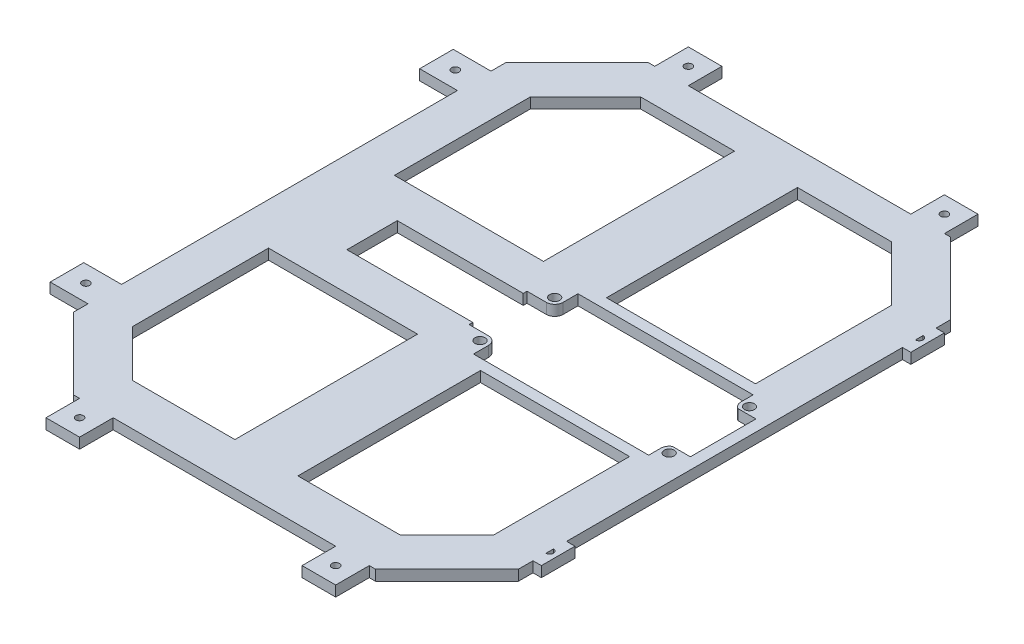
from build123d import *

# Parameters (mm, degrees)
SKETCH1_W               = 106
SKETCH1_H               = 137
BOSS_EXTRUDE1_DEPTH     = 2.5
CUT_EXTRUDE1_DEPTH      = 174.237553665
CUT_EXTRUDE1_DEPTH_BACK = 174.237553665
SKETCH5_W               = 8
SKETCH5_H               = 8
SKETCH5_R               = 0.9
SKETCH5_W_2             = 9
BOSS_EXTRUDE4_DEPTH     = 2.5
CUT_EXTRUDE4_DEPTH      = 181.818278943
CUT_EXTRUDE4_DEPTH_BACK = 181.818278943
SKETCH3_R               = 1.2
SKETCH3_W               = 6.263237977
SKETCH3_H               = 0.25
SKETCH3_W_2             = 4.268245837
CUT_EXTRUDE5_DEPTH      = 181.818278943
CUT_EXTRUDE5_DEPTH_BACK = 181.818278943
SKETCH7_W               = 30
SKETCH7_H               = 12


with BuildPart() as part:
    # Sketch1 → Boss-Extrude1 (new body)
    with BuildSketch(Plane(origin=(0, 0, 0), x_dir=(1, 0, 0), z_dir=(0, 1, 0))):
        with Locations((53, -68.5)):
            Rectangle(SKETCH1_W, SKETCH1_H)
    extrude(amount=BOSS_EXTRUDE1_DEPTH)

    # Sketch2 → Cut-Extrude1 (cut, two sides: drawn at the far end of the back side and taken through both)
    with BuildSketch(Plane(origin=(0, 2.5, 0), x_dir=(1, 0, 0), z_dir=(0, 1, 0)).offset(-CUT_EXTRUDE1_DEPTH_BACK)):
        Polygon((60.5, -83.5), (96, -83.5), (96, -115.857864376), (84.857864376, -127), (60.5, -127), align=None)
        Polygon((106, -120), (89, -137), (106, -137), align=None)
        Polygon((17, -137), (0, -120), (0, -137), align=None)
        Polygon((45.5, -127), (21.142135624, -127), (10, -115.857864376), (10, -83.5), (45.5, -83.5), align=None)
        Polygon((10, -53.5), (45.5, -53.5), (45.5, -8), (23.142135624, -8), (10, -21.142135624), align=None)
        Polygon((60.5, -53.5), (60.5, -8), (82.857864376, -8), (96, -21.142135624), (96, -53.5), align=None)
        Polygon((106, 0), (89, 0), (106, -17), align=None)
        Polygon((0, 0), (0, -17), (17, 0), align=None)
    extrude(amount=CUT_EXTRUDE1_DEPTH + CUT_EXTRUDE1_DEPTH_BACK, mode=Mode.SUBTRACT)

    # Sketch5 → Boss-Extrude4 (add)
    # profile 1 of 8: a face of its own
    with BuildSketch(Plane(origin=(0, 0, 0), x_dir=(1, 0, 0), z_dir=(0, 1, 0))):
        with Locations((22.5, -141)):
            Rectangle(SKETCH5_W, SKETCH5_H)
        with Locations(Location((22.5, -141, 0), (0, 0, 270))):
            Circle(SKETCH5_R, mode=Mode.SUBTRACT)
    # profile 2 of 8: a face of its own
    with BuildSketch(Plane(origin=(0, 0, 0), x_dir=(1, 0, 0), z_dir=(0, 1, 0))):
        with Locations((83.5, -141)):
            Rectangle(SKETCH5_W, SKETCH5_H)
        with Locations(Location((83.5, -141, 0), (0, 0, 270))):
            Circle(SKETCH5_R, mode=Mode.SUBTRACT)
    # profile 3 of 8: a face of its own
    with BuildSketch(Plane(origin=(0, 0, 0), x_dir=(1, 0, 0), z_dir=(0, 1, 0))):
        with Locations((83.5, 4)):
            Rectangle(SKETCH5_W, SKETCH5_H)
        with Locations(Location((83.5, 4, 0), (0, 0, 270))):
            Circle(SKETCH5_R, mode=Mode.SUBTRACT)
    # profile 4 of 8: a face of its own
    with BuildSketch(Plane(origin=(0, 0, 0), x_dir=(1, 0, 0), z_dir=(0, 1, 0))):
        with Locations((22.5, 4)):
            Rectangle(SKETCH5_W, SKETCH5_H)
        with Locations(Location((22.5, 4, 0), (0, 0, 270))):
            Circle(SKETCH5_R, mode=Mode.SUBTRACT)
    # profile 5 of 8: a face of its own
    with BuildSketch(Plane(origin=(0, 0, 0), x_dir=(1, 0, 0), z_dir=(0, 1, 0))):
        with Locations((-4.5, -112.5)):
            Rectangle(SKETCH5_W_2, SKETCH5_H)
        with Locations(Location((-4.5, -112.5, 0), (0, 0, 270))):
            Circle(SKETCH5_R, mode=Mode.SUBTRACT)
    # profile 6 of 8: a face of its own
    with BuildSketch(Plane(origin=(0, 0, 0), x_dir=(1, 0, 0), z_dir=(0, 1, 0))):
        with Locations((-4.5, -24.5)):
            Rectangle(SKETCH5_W_2, SKETCH5_H)
        with Locations(Location((-4.5, -24.5, 0), (0, 0, 270))):
            Circle(SKETCH5_R, mode=Mode.SUBTRACT)
    # profile 7 of 8: a face of its own
    with BuildSketch(Plane(origin=(0, 0, 0), x_dir=(1, 0, 0), z_dir=(0, 1, 0))):
        with BuildLine():
            Line((106, -113.4), (106, -116.5))
            Line((106, -116.5), (108, -116.5))
            Line((108, -116.5), (108, -108.5))
            Line((108, -108.5), (106, -108.5))
            Line((106, -108.5), (106, -111.6))
            ThreePointArc((106, -111.6), (106.9, -112.5), (106, -113.4))
        make_face()
    # profile 8 of 8: a face of its own
    with BuildSketch(Plane(origin=(0, 0, 0), x_dir=(1, 0, 0), z_dir=(0, 1, 0))):
        with BuildLine():
            Line((106, -25.4), (106, -28.5))
            Line((106, -28.5), (108, -28.5))
            Line((108, -28.5), (108, -20.5))
            Line((108, -20.5), (106, -20.5))
            Line((106, -20.5), (106, -23.6))
            ThreePointArc((106, -23.6), (106.9, -24.5), (106, -25.4))
        make_face()
    extrude(amount=BOSS_EXTRUDE4_DEPTH)

    # Sketch3 → Cut-Extrude4 (cut, two sides: drawn at the far end of the back side and taken through both)
    with BuildSketch(Plane(origin=(0, 2.5, 0), x_dir=(1, 0, 0), z_dir=(0, 1, 0)).offset(-CUT_EXTRUDE4_DEPTH_BACK)):
        with BuildLine():
            Line((56.27559049, -77.39), (56.27559049, -80.94))
            Line((56.27559049, -80.94), (98, -80.94))
            Line((98, -80.94), (98, -78.05675))
            ThreePointArc((98, -78.05675), (98.277140216, -77.040996997), (99.031754163, -76.30675))
            Line((99.031754163, -76.30675), (99.031754163, -76.05675))
            Line((99.031754163, -76.05675), (100, -76.05675))
            Line((100, -76.05675), (103.3, -76.05675))
            Line((103.3, -76.05675), (103.3, -60.94325))
            Line((103.3, -60.94325), (100, -60.94325))
            Line((100, -60.94325), (97.036762023, -60.94325))
            Line((97.036762023, -60.94325), (97.036762023, -60.69325))
            Line((97.036762023, -60.69325), (99.031754163, -60.69325))
            ThreePointArc((99.031754163, -60.69325), (98.277140216, -59.959003003), (98, -58.94325))
            Line((98, -58.94325), (98, -56.06))
            Line((98, -56.06), (56.27559049, -56.06))
            Line((56.27559049, -56.06), (56.27559049, -59.61))
            ThreePointArc((56.27559049, -59.61), (55.689804052, -61.024213562), (54.27559049, -61.61))
            Line((54.27559049, -61.61), (49.67559049, -61.61))
            Line((49.67559049, -61.61), (49.67559049, -75.39))
            Line((49.67559049, -75.39), (54.27559049, -75.39))
            ThreePointArc((54.27559049, -75.39), (55.689804052, -75.975786438), (56.27559049, -77.39))
        make_face()
        with Locations(Location((54.27559049, -59.61, 0), (0, 0, 270))):
            Circle(SKETCH3_R)
        with Locations(Location((54.27559049, -77.39, 0), (0, 0, 270))):
            Circle(SKETCH3_R)
        with Locations(Location((100, -78.05675, 0), (0, 0, 270))):
            Circle(SKETCH3_R)
        with Locations(Location((100, -58.94325, 0), (0, 0, 270))):
            Circle(SKETCH3_R)
        with Locations((100.168381012, -60.81825)):
            Rectangle(SKETCH3_W, SKETCH3_H)
        with Locations((101.165877082, -76.18175)):
            Rectangle(SKETCH3_W_2, SKETCH3_H)
    extrude(amount=CUT_EXTRUDE4_DEPTH + CUT_EXTRUDE4_DEPTH_BACK, mode=Mode.SUBTRACT)

    # Sketch7 → Cut-Extrude5 (cut, two sides: drawn at the far end of the back side and taken through both)
    with BuildSketch(Plane(origin=(0, 2.5, 0), x_dir=(1, 0, 0), z_dir=(0, 1, 0)).offset(-CUT_EXTRUDE5_DEPTH_BACK)):
        with Locations((34.67559049, -68.5)):
            Rectangle(SKETCH7_W, SKETCH7_H)
    extrude(amount=CUT_EXTRUDE5_DEPTH + CUT_EXTRUDE5_DEPTH_BACK, mode=Mode.SUBTRACT)


solid = part.part
